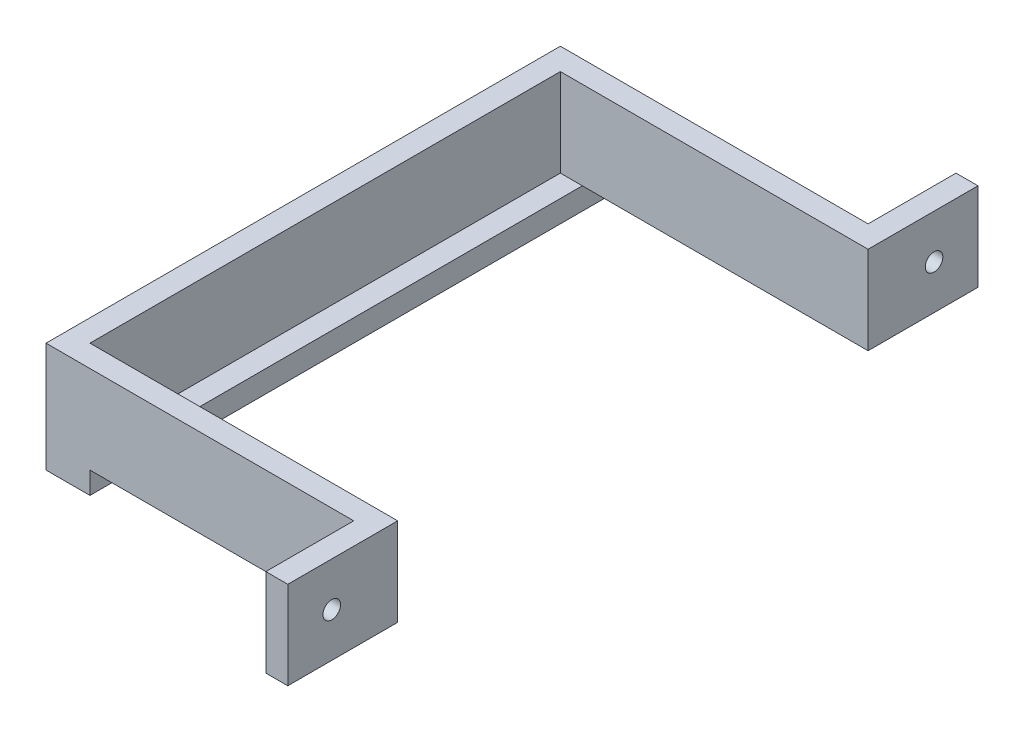
from build123d import *

# Parameters (mm, degrees)
SKETCH1_W           = 117
SKETCH1_H           = 20
BOSS_EXTRUDE1_DEPTH = 5
SKETCH2_W           = 5
SKETCH2_H           = 20
BOSS_EXTRUDE2_DEPTH = 70
SKETCH3_W           = 10
SKETCH3_H           = 117
BOSS_EXTRUDE3_DEPTH = 5
SKETCH4_W           = 5
SKETCH4_H           = 20
BOSS_EXTRUDE4_DEPTH = 20
SKETCH5_W           = 5
SKETCH5_H           = 20
BOSS_EXTRUDE5_DEPTH = 20
SKETCH6_R           = 2
CUT_EXTRUDE1_DEPTH  = 5


with BuildPart() as part:
    # Sketch1 → Boss-Extrude1 (new body)
    with BuildSketch(Plane(origin=(0, 0, 0), x_dir=(0, 0, -1), z_dir=(1, 0, 0))):
        Rectangle(SKETCH1_W, SKETCH1_H)
    extrude(amount=BOSS_EXTRUDE1_DEPTH)

    # Sketch2 → Boss-Extrude2 (add)
    with BuildSketch(Plane(origin=(5, 0, 0), x_dir=(0, 0, -1), z_dir=(1, 0, 0))):
        with Locations((-56, 0)):
            Rectangle(SKETCH2_W, SKETCH2_H)
        with Locations((56, 0)):
            Rectangle(SKETCH2_W, SKETCH2_H)
    extrude(amount=BOSS_EXTRUDE2_DEPTH)

    # Sketch3 → Boss-Extrude3 (add)
    with BuildSketch(Plane.XZ.offset(10)):
        with Locations((5, 0)):
            Rectangle(SKETCH3_W, SKETCH3_H)
    extrude(amount=BOSS_EXTRUDE3_DEPTH)

    # Sketch4 → Boss-Extrude4 (add)
    with BuildSketch(Plane.XY.offset(58.5)):
        with Locations((72.5, 0)):
            Rectangle(SKETCH4_W, SKETCH4_H)
    extrude(amount=BOSS_EXTRUDE4_DEPTH)

    # Sketch5 → Boss-Extrude5 (add)
    with BuildSketch(Plane(origin=(0, 0, -58.5), x_dir=(-1, 0, 0), z_dir=(0, 0, -1))):
        with Locations((-72.5, 0)):
            Rectangle(SKETCH5_W, SKETCH5_H)
    extrude(amount=BOSS_EXTRUDE5_DEPTH)

    # Sketch6 → Cut-Extrude1 (cut)
    with BuildSketch(Plane.ZY.offset(-70)):
        with Locations((-68.5, 0)):
            Circle(SKETCH6_R)
        with Locations((68.5, 0)):
            Circle(SKETCH6_R)
    extrude(amount=-CUT_EXTRUDE1_DEPTH, mode=Mode.SUBTRACT)


solid = part.part
